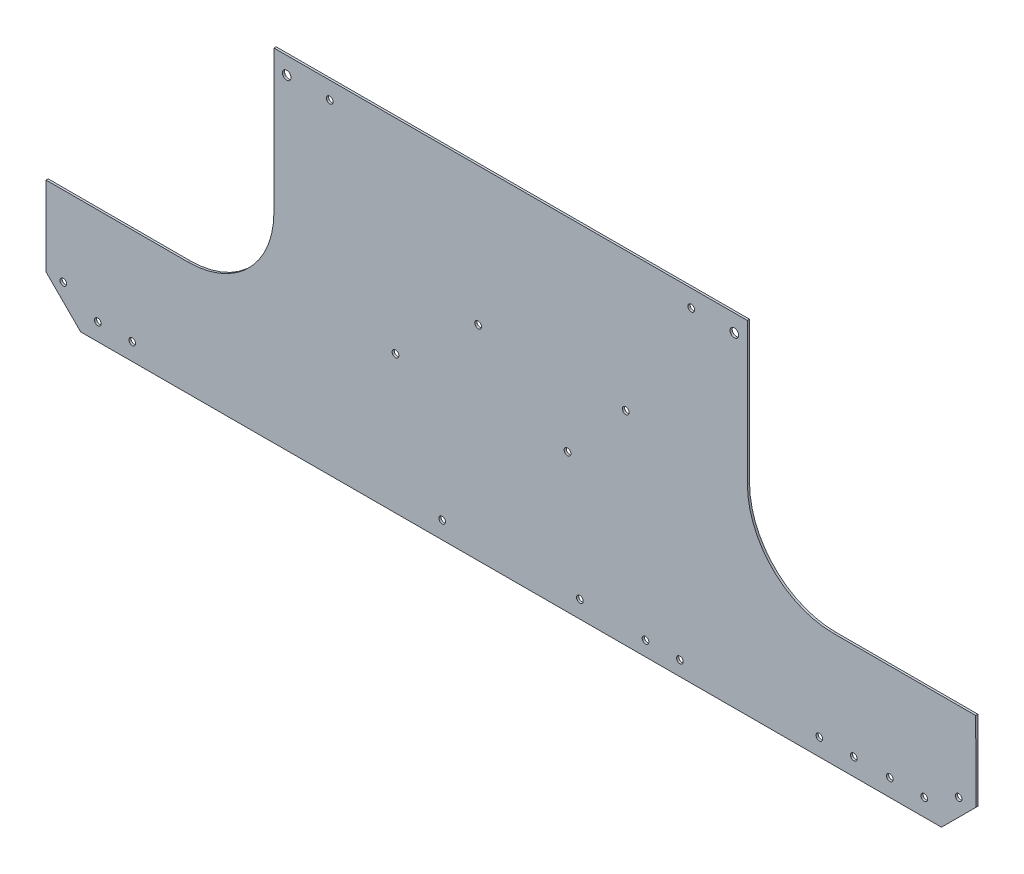
from build123d import *

# Parameters (mm, degrees)
SKETCH3_W                    = 914.4
SKETCH3_H                    = 609.6
BOSS_EXTRUDE1_DEPTH          = 0.79375
SKETCH4_OUTSIDE_W            = 1136.194
SKETCH4_OUTSIDE_H            = 831.394
CUT_EXTRUDE1_DEPTH           = 2.54
F_10_0_1935_DIAMETER_HOLE1_D = 4.9149
CUT_EXTRUDE5_DEPTH           = 2.54
CUT_EXTRUDE6_DEPTH           = 2.54
F_1_4_0_25_DIAMETER_HOLE1_D  = 6.35
F_10_CLEARANCE_HOLE1_D       = 4.9784


with BuildPart() as part:
    # Sketch3 → Boss-Extrude1 (new, symmetric)
    with BuildSketch(Plane.XY):
        Rectangle(SKETCH3_W, SKETCH3_H)
    extrude(amount=BOSS_EXTRUDE1_DEPTH, both=True)

    # Sketch4 outside → Cut-Extrude1 (cut)
    with BuildSketch(Plane.XY.offset(0.79375)):
        Rectangle(SKETCH4_OUTSIDE_W, SKETCH4_OUTSIDE_H)
        with BuildLine():
            Line((-362.506554298, 0.447439942), (318.21252852, 1.564886415))
            ThreePointArc((318.21252852, 1.564886415), (320.009798565, 0.823886977), (320.756694674, -0.970940586))
            Line((320.756694674, -0.970940586), (321.125317657, -225.526391983))
            Line((321.125317657, -225.526391983), (295.766909962, -250.884799679))
            Line((295.766909962, -250.884799679), (-339.232233443, -251.927193706))
            Line((-339.232233443, -251.927193706), (-364.674032102, -226.485395047))
            Line((-364.674032102, -226.485395047), (-365.0423813, -2.096726212))
            ThreePointArc((-365.0423813, -2.096726212), (-364.301381862, -0.299456167), (-362.506554298, 0.447439942))
        make_face(mode=Mode.SUBTRACT)
    extrude(amount=-CUT_EXTRUDE1_DEPTH, mode=Mode.SUBTRACT)

    # #10 (0.1935) Diameter Hole1 (through all)
    with Locations(Plane.XY.offset(0.79375)):
        with Locations((-301.153133674, -239.164667177), (-326.553099451, -239.206362941), (-351.97391311, -226.548075817), (-72.553441175, -238.789405326), (29.046421932, -238.622622281), (77.43654747, -240.486594059), (102.836513247, -240.444898294), (205.703184417, -238.332628273), (231.103150194, -238.290932508), (257.646113416, -238.247360435), (283.046079193, -238.205664671), (308.425197087, -225.463986018), (-155.475985843, -11.912722419), (111.223655321, -11.474916927)):
            Hole(F_10_0_1935_DIAMETER_HOLE1_D / 2)

    # Sketch13 → Cut-Extrude5 (cut)
    with BuildSketch(Plane(origin=(0, 0, -0.79375), x_dir=(-1, 0, 0), z_dir=(0, 0, -1))):
        with BuildLine():
            Line((-216.217386967, -166.841258451), (-343.254011981, -166.841258451))
            Line((-343.254011981, -166.841258451), (-342.941011359, 23.830509847))
            Line((-342.941011359, 23.830509847), (-152.613233115, 23.518073908))
            Line((-152.613233115, 23.518073908), (-152.613233115, -103.237104599))
            ThreePointArc((-152.613233115, -103.237104599), (-171.211866952, -148.242624615), (-216.217386967, -166.841258451))
        make_face()
    extrude(amount=-CUT_EXTRUDE5_DEPTH, mode=Mode.SUBTRACT)

    # Sketch12 → Cut-Extrude6 (cut)
    with BuildSketch(Plane(origin=(0, 0, -0.79375), x_dir=(-1, 0, 0), z_dir=(0, 0, -1))):
        with BuildLine():
            Line((196.636236426, -104.091867765), (196.636236426, 20.404753749))
            Line((196.636236426, 20.404753749), (384.763838571, 20.095930202))
            Line((384.763838571, 20.095930202), (384.455565363, -167.696021617))
            Line((384.455565363, -167.696021617), (260.031911457, -167.696021617))
            ThreePointArc((260.031911457, -167.696021617), (215.161222367, -149.023618888), (196.636236426, -104.091867765))
        make_face()
    extrude(amount=-CUT_EXTRUDE6_DEPTH, mode=Mode.SUBTRACT)

    # 1/4 (0.25) Diameter Hole1 (through all)
    with Locations(Plane(origin=(0, 0, -0.79375), x_dir=(-1, 0, 0), z_dir=(0, 0, -1))):
        with Locations((-142.973612542, -11.422797239), (187.225942556, -11.964842173)):
            Hole(F_1_4_0_25_DIAMETER_HOLE1_D / 2)

    # #10 Clearance Hole1 (through all)
    with Locations(Plane(origin=(0, 0, -0.79375), x_dir=(-1, 0, 0), z_dir=(0, 0, -1))):
        with Locations((-62.885205352, -101.186991996), (-19.917204705, -149.007237749), (46.027185416, -100.817324835), (106.973826127, -149.761638685)):
            Hole(F_10_CLEARANCE_HOLE1_D / 2)


solid = part.part
